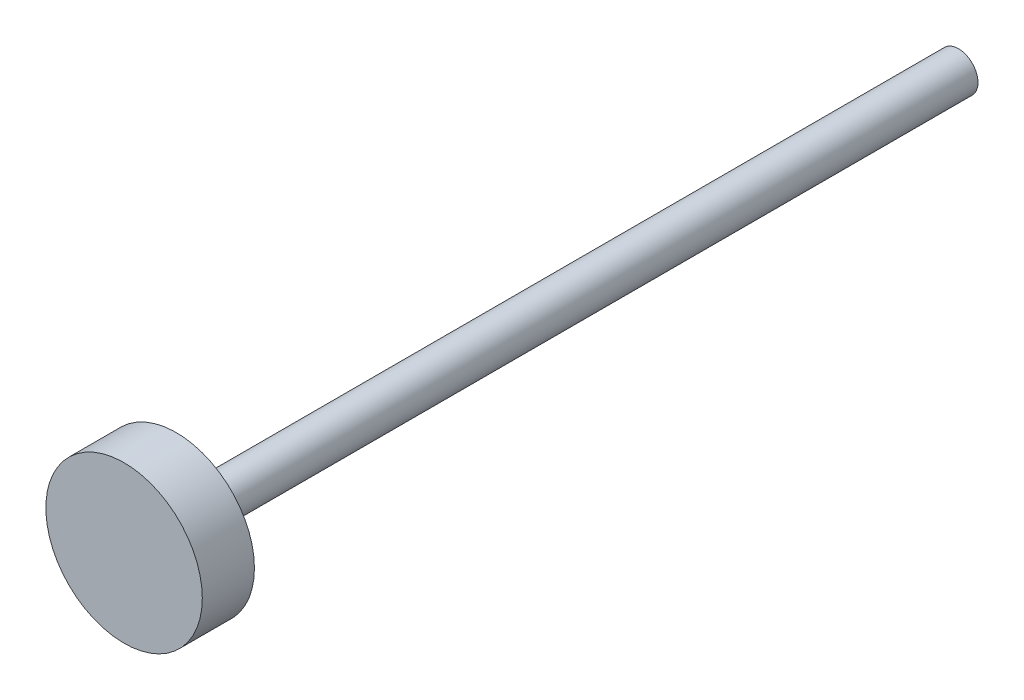
from build123d import *


with BuildPart() as part:
    # Sketch2 → Revolve1 (revolve)
    with BuildSketch(Plane(origin=(0, 0, 0), x_dir=(0, 0, -1), z_dir=(1, 0, 0)), mode=Mode.PRIVATE) as revolve1_sk:
        Polygon((0, 0), (0, -1.5), (-60, -1.5), (-60, -6), (-64, -6), (-64, 0), align=None)
    revolve(revolve1_sk.sketch.rotate(Axis((0, 0, 64), (0, 0, -1)), 270), axis=Axis((0, 0, 64), (0, 0, -1)))


solid = part.part
